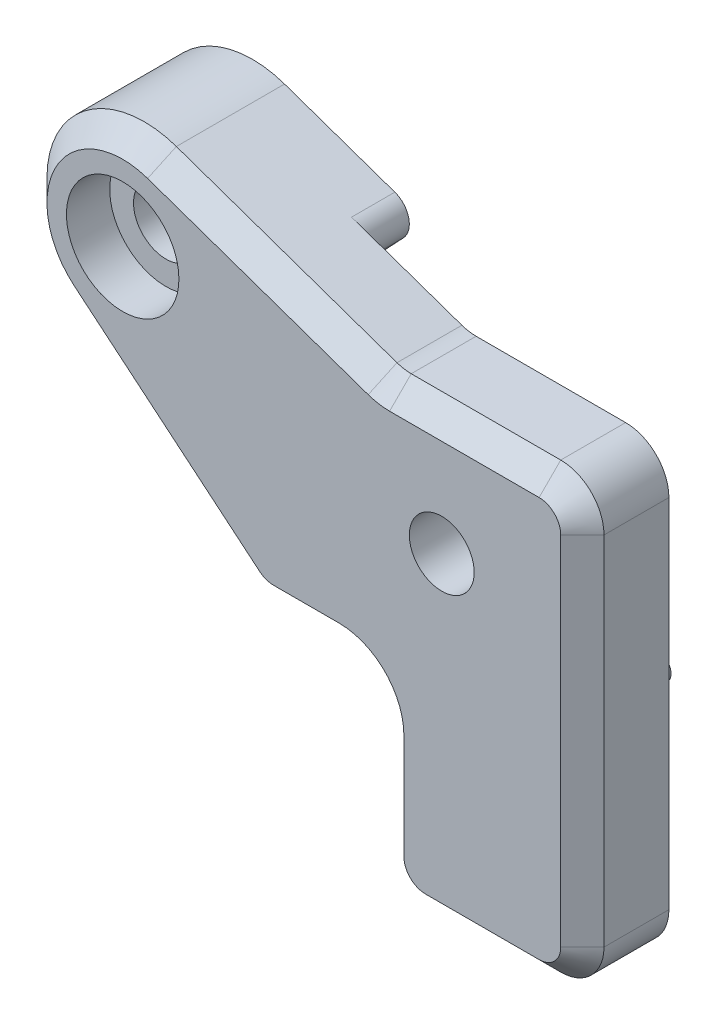
from build123d import *

# Parameters (mm, degrees)
SKETCH1_R           = 1.5
BOSS_EXTRUDE1_DEPTH = 2
FILLET1_R           = 2
SKETCH2_R           = 1.5
SKETCH2_R_2         = 2.6
BOSS_EXTRUDE2_DEPTH = 2
CHAMFER1_SIZE       = 1
SKETCH3_R           = 1
BOSS_EXTRUDE3_DEPTH = 6
CHAMFER2_SIZE       = 3.5
CHAMFER2_SIZE2      = 0.4
SKETCH4_R           = 1.5
BOSS_EXTRUDE4_DEPTH = 2


with BuildPart() as part:
    # Sketch1 → Boss-Extrude1 (new body)
    with BuildSketch(Plane.XY):
        with BuildLine():
            Line((-2.75, -15), (-2.75, -6.15))
            Line((-2.75, -6.15), (-8.5, -6.15))
            Line((-8.5, -6.15), (-17.631690269, 1.463594463))
            ThreePointArc((-17.631690269, 1.463594463), (-18.665645679, 7.137466027), (-13.267909941, 9.168803324))
            Line((-13.267909941, 9.168803324), (-2.75, 5.5))
            Line((-2.75, 5.5), (6.5, 5.5))
            Line((6.5, 5.5), (6.5, -15))
            Line((6.5, -15), (-2.75, -15))
        make_face()
        Circle(SKETCH1_R, mode=Mode.SUBTRACT)
        with Locations((-14.75, 4.919872981)):
            Circle(SKETCH1_R, mode=Mode.SUBTRACT)
    extrude(amount=-BOSS_EXTRUDE1_DEPTH)

    # Fillet1
    fillet1_edges = [part.edges().sort_by_distance(p)[0] for p in [
        (6.5, -15, -1),
        (-2.75, -15, -1),
        (-2.75, -6.15, -1),
        (-8.5, -6.15, -1),
        (-2.75, 5.5, -1),
        (6.5, 5.5, -1),
    ]]
    fillet(fillet1_edges, radius=FILLET1_R)

    # Sketch2 → Boss-Extrude2 (add)
    with BuildSketch(Plane.XY):
        with BuildLine():
            Line((-0.75, -15), (4.5, -15))
            ThreePointArc((4.5, -15), (5.914213562, -14.414213562), (6.5, -13))
            Line((6.5, -13), (6.5, 3.5))
            ThreePointArc((6.5, 3.5), (5.914213562, 4.914213562), (4.5, 5.5))
            Line((4.5, 5.5), (-2.41119514, 5.5))
            ThreePointArc((-2.41119514, 5.5), (-2.745240817, 5.528093946), (-3.069901833, 5.611586514))
            Line((-3.069901833, 5.611586514), (-13.267909941, 9.168803324))
            ThreePointArc((-13.267909941, 9.168803324), (-18.665645679, 7.137466027), (-17.631690269, 1.463594463))
            Line((-17.631690269, 1.463594463), (-9.056369785, -5.686123786))
            ThreePointArc((-9.056369785, -5.686123786), (-8.456703141, -6.030458398), (-7.775618554, -6.15))
            Line((-7.775618554, -6.15), (-4.75, -6.15))
            ThreePointArc((-4.75, -6.15), (-3.335786438, -6.735786438), (-2.75, -8.15))
            Line((-2.75, -8.15), (-2.75, -13))
            ThreePointArc((-2.75, -13), (-2.164213562, -14.414213562), (-0.75, -15))
        make_face()
        Circle(SKETCH2_R, mode=Mode.SUBTRACT)
        with Locations((-14.75, 4.919872981)):
            Circle(SKETCH2_R_2, mode=Mode.SUBTRACT)
    extrude(amount=BOSS_EXTRUDE2_DEPTH)

    # Chamfer1
    chamfer1_edges = [part.edges().sort_by_distance(p)[0] for p in [
        (-2.164213562, -14.414213562, 2),
        (1.875, -15, 2),
        (5.914213562, -14.414213562, 2),
        (6.5, -4.75, 2),
        (5.914213562, 4.914213562, 2),
        (1.04440243, 5.5, 2),
        (-2.745240817, 5.528093946, 2),
        (-8.168905887, 7.390194919, 2),
        (-18.665645679, 7.137466027, 2),
        (-13.344030027, -2.111264661, 2),
        (-8.456703141, -6.030458398, 2),
        (-6.262809277, -6.15, 2),
        (-3.335786438, -6.735786438, 2),
        (-2.75, -10.575, 2),
    ]]
    chamfer(chamfer1_edges, length=CHAMFER1_SIZE)

    # Sketch3 → Boss-Extrude3 (add)
    with BuildSketch(Plane(origin=(0, 0, -2), x_dir=(-1, 0, 0), z_dir=(0, 0, -1))):
        with Locations(Location((0, -9.5, 0), (0, 0, 180))):
            Circle(SKETCH3_R)
    extrude(amount=BOSS_EXTRUDE3_DEPTH)

    # Chamfer2
    chamfer2_edges = [part.edges().sort_by_distance(p)[0] for p in [
        (-1, -9.5, -8),
    ]]
    chamfer2_side = [part.faces().sort_by_distance(p)[0] for p in [
        (-1, -9.5, -5),
    ]]
    chamfer(chamfer2_edges, length=CHAMFER2_SIZE, length2=CHAMFER2_SIZE2, reference=chamfer2_side[0])

    # Sketch4 → Boss-Extrude4 (add)
    with BuildSketch(Plane(origin=(0, 0, -2), x_dir=(-1, 0, 0), z_dir=(0, 0, -1))):
        with BuildLine():
            Line((13.267909941, 9.168803324), (8.168905887, 7.390194919))
            ThreePointArc((8.168905887, 7.390194919), (7.526785431, 6.683135075), (7.770894189, 5.759737426))
            Line((7.770894189, 5.759737426), (11.476857302, 1.831744604))
            ThreePointArc((11.476857302, 1.831744604), (19.121632111, 3.852711939), (13.267909941, 9.168803324))
        make_face()
        with Locations(Location((14.75, 4.919872981, 0), (0, 0, 180))):
            Circle(SKETCH4_R, mode=Mode.SUBTRACT)
    extrude(amount=BOSS_EXTRUDE4_DEPTH)


solid = part.part
